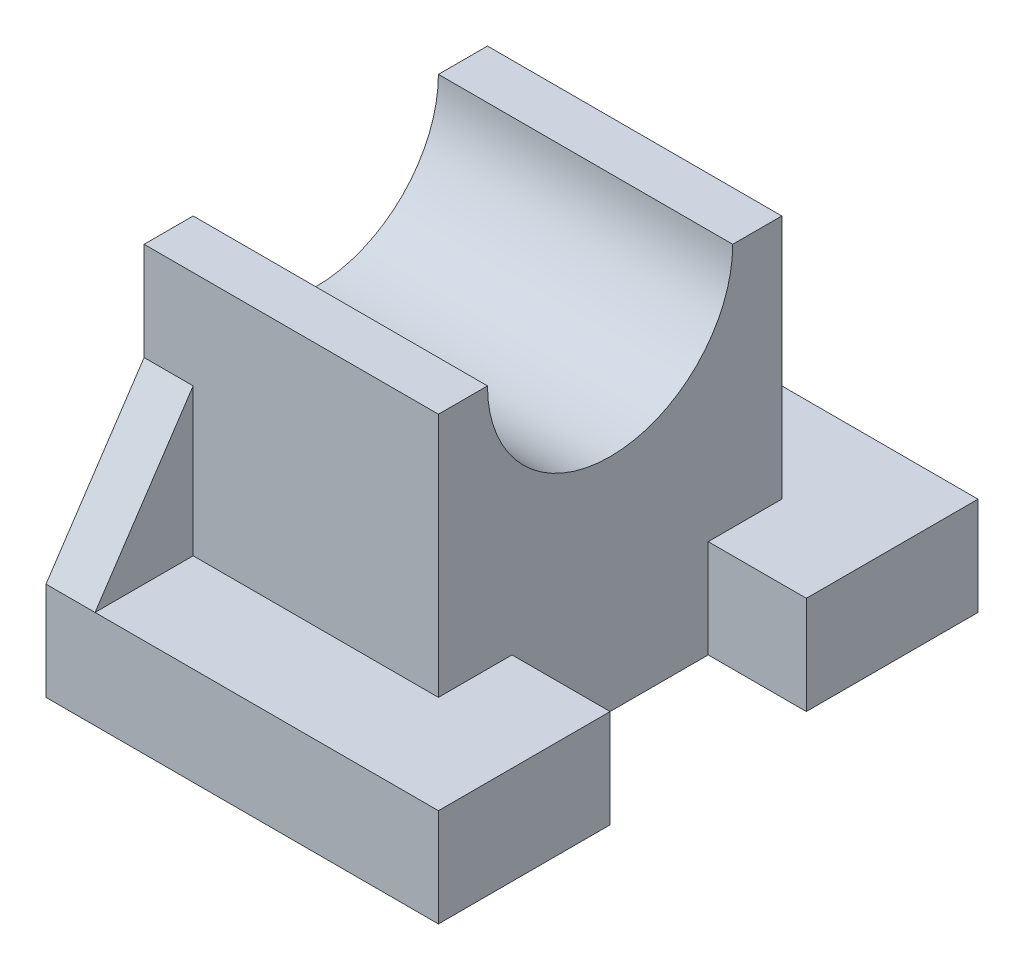
from build123d import *

# Parameters (mm, degrees)
SKETCH_3_W               = 80
SKETCH_3_H               = 110
EXTRUDE_2_DEPTH          = 20
SKETCH_4_W               = 60
SKETCH_4_H               = 70
EXTRUDE_3_DEPTH          = 70
SKETCH_5_W               = 10
SKETCH_5_H               = 110
EXTRUDE_4_DEPTH          = 50
SKETCH_6_W               = 20
SKETCH_6_H               = 40
CUT_EXTRUDE_1_DEPTH      = 98.59610648
CUT_EXTRUDE_2_DEPTH      = 98.59610648
CUT_EXTRUDE_3_DEPTH      = 98.59610648
CUT_EXTRUDE_3_DEPTH_BACK = 98.59610648
SKETCH_8_R               = 25


with BuildPart() as part:
    # Эскиз3 → Бобышка-Вытянуть2 (new body)
    with BuildSketch(Plane(origin=(0, 0, 0), x_dir=(1, 0, 0), z_dir=(0, 1, 0))):
        Rectangle(SKETCH_3_W, SKETCH_3_H)
    extrude(amount=EXTRUDE_2_DEPTH)

    # Эскиз4 → Бобышка-Вытянуть3 (add)
    with BuildSketch(Plane(origin=(0, 0, 0), x_dir=(1, 0, 0), z_dir=(0, 1, 0))):
        with Locations((-10, 0)):
            Rectangle(SKETCH_4_W, SKETCH_4_H)
    extrude(amount=EXTRUDE_3_DEPTH)

    # Эскиз5 → Бобышка-Вытянуть4 (add)
    with BuildSketch(Plane(origin=(0, 0, 0), x_dir=(1, 0, 0), z_dir=(0, 1, 0))):
        with Locations((-35, 0)):
            Rectangle(SKETCH_5_W, SKETCH_5_H)
    extrude(amount=EXTRUDE_4_DEPTH)

    # Эскиз6 → Вырез-Вытянуть1 (cut, through all)
    with BuildSketch(Plane(origin=(0, 0, 0), x_dir=(1, 0, 0), z_dir=(0, 1, 0))):
        with Locations((30, 0)):
            Rectangle(SKETCH_6_W, SKETCH_6_H)
    extrude(amount=CUT_EXTRUDE_1_DEPTH, mode=Mode.SUBTRACT)

    # Эскиз7 → Вырез-Вытянуть2 (cut, through all)
    with BuildSketch(Plane(origin=(0, 0, 0), x_dir=(0, 0, -1), z_dir=(1, 0, 0))):
        Polygon((-55, 20), (-35, 50), (-55, 50), align=None)
        Polygon((55, 20), (35, 50), (55, 50), align=None)
    extrude(amount=-CUT_EXTRUDE_2_DEPTH, mode=Mode.SUBTRACT)

    # Эскиз8 → Вырез-Вытянуть3 (cut, two sides: drawn at the far end of the back side and taken through both)
    with BuildSketch(Plane(origin=(0, 0, 0), x_dir=(0, 0, -1), z_dir=(1, 0, 0)).offset(-CUT_EXTRUDE_3_DEPTH_BACK)):
        with Locations((0, 70)):
            Circle(SKETCH_8_R)
    extrude(amount=CUT_EXTRUDE_3_DEPTH + CUT_EXTRUDE_3_DEPTH_BACK, mode=Mode.SUBTRACT)


solid = part.part
